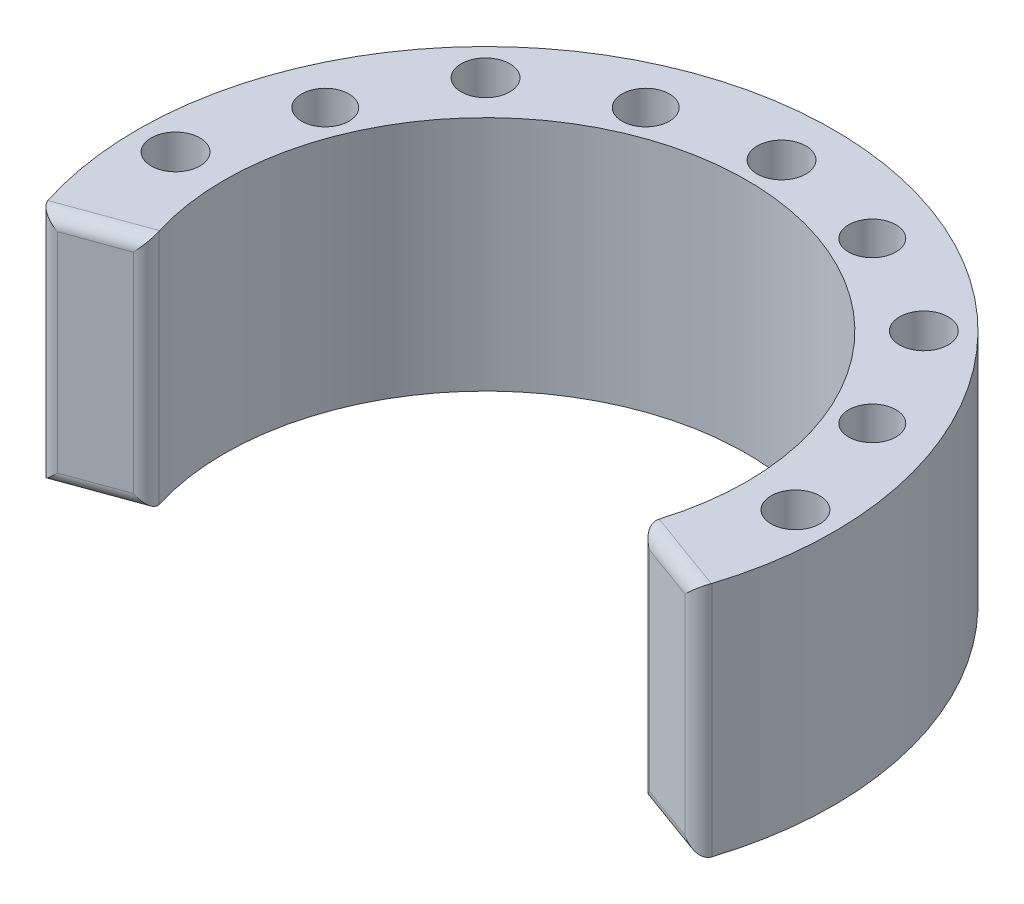
from build123d import *

# Parameters (mm, degrees)
SKETCH_1_R           = 50
SKETCH_1_R_2         = 37.5
SKETCH_1_R_3         = 1.9
EXTRUDE_2_DEPTH      = 34
CUT_EXTRUDE_START    = -34
SKETCH_2_R           = 1.9
CUT_EXTRUDE_1_DEPTH  = 34
CUT_EXTRUDE_START_2  = -27
SKETCH_3_R           = 3.5
SKETCH_3_R_2         = 1.9
CUT_EXTRUDE_2_DEPTH  = 27
SKETCH_6_R           = 3.4
CUT_EXTRUDE_3_DEPTH  = 10
FILLET_3_R           = 2
EXTRUDE_4_DEPTH      = 4
EXTRUDE_4_DEPTH_BACK = 1
CUT_EXTRUDE_START_3  = -7
SKETCH_9_R           = 1.9
CUT_EXTRUDE_5_DEPTH  = 7


with BuildPart() as part:
    # 草图1 → 凸台-拉伸2 (new body)
    with BuildSketch(Plane(origin=(0, 0, 0), x_dir=(1, 0, 0), z_dir=(0, 1, 0))):
        with Locations(Location((0, 0, 0), (0, 0, 270))):
            Circle(SKETCH_1_R)
        with Locations(Location((0, 0, 0), (0, 0, 270))):
            Circle(SKETCH_1_R_2, mode=Mode.SUBTRACT)
        with Locations(Location((31.466251763, 31.466251763, 0), (0, 0, 270))):
            Circle(SKETCH_1_R_3, mode=Mode.SUBTRACT)
        with Locations(Location((44.5, 0, 0), (0, 0, 270))):
            Circle(SKETCH_1_R_3, mode=Mode.SUBTRACT)
        with Locations(Location((31.466251763, -31.466251763, 0), (0, 0, 270))):
            Circle(SKETCH_1_R_3, mode=Mode.SUBTRACT)
        with Locations(Location((-31.466251763, -31.466251763, 0), (0, 0, 270))):
            Circle(SKETCH_1_R_3, mode=Mode.SUBTRACT)
        with Locations(Location((-44.5, 0, 0), (0, 0, 270))):
            Circle(SKETCH_1_R_3, mode=Mode.SUBTRACT)
        with Locations(Location((-31.466251763, 31.466251763, 0), (0, 0, 270))):
            Circle(SKETCH_1_R_3, mode=Mode.SUBTRACT)
        with Locations(Location((0, 42.5, 0), (0, 0, 270))):
            Circle(SKETCH_1_R_3, mode=Mode.SUBTRACT)
    extrude(amount=EXTRUDE_2_DEPTH)

    # 草图2 → 切除-拉伸1 (cut)
    with BuildSketch(Plane(origin=(0, 34, 0), x_dir=(1, 0, 0), z_dir=(0, 1, 0)).offset(CUT_EXTRUDE_START)):
        with BuildLine():
            ThreePointArc((35.238473279, -12.825755375), (0, -37.5), (-35.238473279, -12.825755375))
            Line((-35.238473279, -12.825755375), (-46.984631039, -17.101007166))
            ThreePointArc((-46.984631039, -17.101007166), (0, -50), (46.984631039, -17.101007166))
            Line((46.984631039, -17.101007166), (35.238473279, -12.825755375))
        make_face()
        with Locations((-31.466251763, -31.466251763)):
            Circle(SKETCH_2_R, mode=Mode.SUBTRACT)
        with Locations((31.466251763, -31.466251763)):
            Circle(SKETCH_2_R, mode=Mode.SUBTRACT)
    extrude(amount=CUT_EXTRUDE_1_DEPTH, mode=Mode.SUBTRACT)

    # 草图3 → 切除-拉伸2 (cut)
    # profile 1 of 5: a face of its own
    with BuildSketch(Plane(origin=(0, 34, 0), x_dir=(1, 0, 0), z_dir=(0, 1, 0)).offset(CUT_EXTRUDE_START_2)):
        with Locations(Location((-44.5, 0, 0), (0, 0, 270))):
            Circle(SKETCH_3_R)
        with Locations(Location((-44.5, 0, 0), (0, 0, 270))):
            Circle(SKETCH_3_R_2, mode=Mode.SUBTRACT)
    # profile 2 of 5: a face of its own
    with BuildSketch(Plane(origin=(0, 34, 0), x_dir=(1, 0, 0), z_dir=(0, 1, 0)).offset(CUT_EXTRUDE_START_2)):
        with Locations(Location((0, 42.5, 0), (0, 0, 270))):
            Circle(SKETCH_3_R)
        with Locations(Location((0, 42.5, 0), (0, 0, 270))):
            Circle(SKETCH_3_R_2, mode=Mode.SUBTRACT)
    # profile 3 of 5: a face of its own
    with BuildSketch(Plane(origin=(0, 34, 0), x_dir=(1, 0, 0), z_dir=(0, 1, 0)).offset(CUT_EXTRUDE_START_2)):
        with Locations(Location((31.466251763, 31.466251763, 0), (0, 0, 270))):
            Circle(SKETCH_3_R)
        with Locations(Location((31.466251763, 31.466251763, 0), (0, 0, 270))):
            Circle(SKETCH_3_R_2, mode=Mode.SUBTRACT)
    # profile 4 of 5: a face of its own
    with BuildSketch(Plane(origin=(0, 34, 0), x_dir=(1, 0, 0), z_dir=(0, 1, 0)).offset(CUT_EXTRUDE_START_2)):
        with Locations(Location((44.5, 0, 0), (0, 0, 270))):
            Circle(SKETCH_3_R)
        with Locations(Location((44.5, 0, 0), (0, 0, 270))):
            Circle(SKETCH_3_R_2, mode=Mode.SUBTRACT)
    # profile 5 of 5: a face of its own
    with BuildSketch(Plane(origin=(0, 34, 0), x_dir=(1, 0, 0), z_dir=(0, 1, 0)).offset(CUT_EXTRUDE_START_2)):
        with Locations(Location((-31.466251763, 31.466251763, 0), (0, 0, 270))):
            Circle(SKETCH_3_R)
    extrude(amount=CUT_EXTRUDE_2_DEPTH, mode=Mode.SUBTRACT)

    # 草图6 → 切除-拉伸3 (cut)
    with BuildSketch(Plane(origin=(0, 34, 0), x_dir=(1, 0, 0), z_dir=(0, 1, 0))):
        with Locations(Location((16.264045876, 39.264880132, 0), (0, 0, 270))):
            Circle(SKETCH_6_R)
        with Locations(Location((39.264880132, 16.264045876, 0), (0, 0, 270))):
            Circle(SKETCH_6_R)
        with Locations(Location((-39.264880132, 16.264045876, 0), (0, 0, 270))):
            Circle(SKETCH_6_R)
        with Locations(Location((-16.264045876, 39.264880132, 0), (0, 0, 270))):
            Circle(SKETCH_6_R)
    extrude(amount=-CUT_EXTRUDE_3_DEPTH, mode=Mode.SUBTRACT)

    # 圆角3
    fillet_3_edges = [part.edges().sort_by_distance(p)[0] for p in [
        (41.111552159, 34, 14.96338127),
        (35.238473279, 17, 12.825755375),
        (46.984631039, 17, 17.101007166),
        (-41.111552159, 0, 14.96338127),
        (-46.984631039, 17, 17.101007166),
        (-35.238473279, 17, 12.825755375),
        (41.111552159, 0, 14.96338127),
        (-41.111552159, 34, 14.96338127),
    ]]
    fillet(fillet_3_edges, radius=FILLET_3_R)

    # 草图8 → 凸台-拉伸4 (add, two sides: drawn at the far end of the back side and taken through both)
    with BuildSketch(Plane.ZY.offset(50).offset(-EXTRUDE_4_DEPTH_BACK)):
        with BuildLine():
            Line((0, 26.4), (0, 27))
            Line((0, 27), (-5, 27))
            Line((-5, 27), (-5, 0))
            Line((-5, 0), (0, 0))
            Line((0, 0), (0, 7.6))
            ThreePointArc((0, 7.6), (-1.9, 9.5), (0, 11.4))
            Line((0, 11.4), (0, 22.6))
            ThreePointArc((0, 22.6), (-1.9, 24.5), (0, 26.4))
        make_face()
        with BuildLine():
            Line((5, 27), (0, 27))
            Line((0, 27), (0, 26.4))
            ThreePointArc((0, 26.4), (1.343502884, 25.843502884), (1.9, 24.5))
            ThreePointArc((1.9, 24.5), (1.343502884, 23.156497116), (0, 22.6))
            Line((0, 22.6), (0, 11.4))
            ThreePointArc((0, 11.4), (1.343502884, 10.843502884), (1.9, 9.5))
            ThreePointArc((1.9, 9.5), (1.343502884, 8.156497116), (0, 7.6))
            Line((0, 7.6), (0, 0))
            Line((0, 0), (5, 0))
            Line((5, 0), (5, 27))
        make_face()
    extrude(amount=EXTRUDE_4_DEPTH + EXTRUDE_4_DEPTH_BACK)

    # 草图9 → 切除-拉伸5 (cut)
    with BuildSketch(Plane.ZY.offset(54).offset(CUT_EXTRUDE_START_3)):
        with Locations((0, 9.5)):
            Circle(SKETCH_9_R)
        with Locations((0, 24.5)):
            Circle(SKETCH_9_R)
    extrude(amount=CUT_EXTRUDE_5_DEPTH, mode=Mode.SUBTRACT)


solid = part.part
